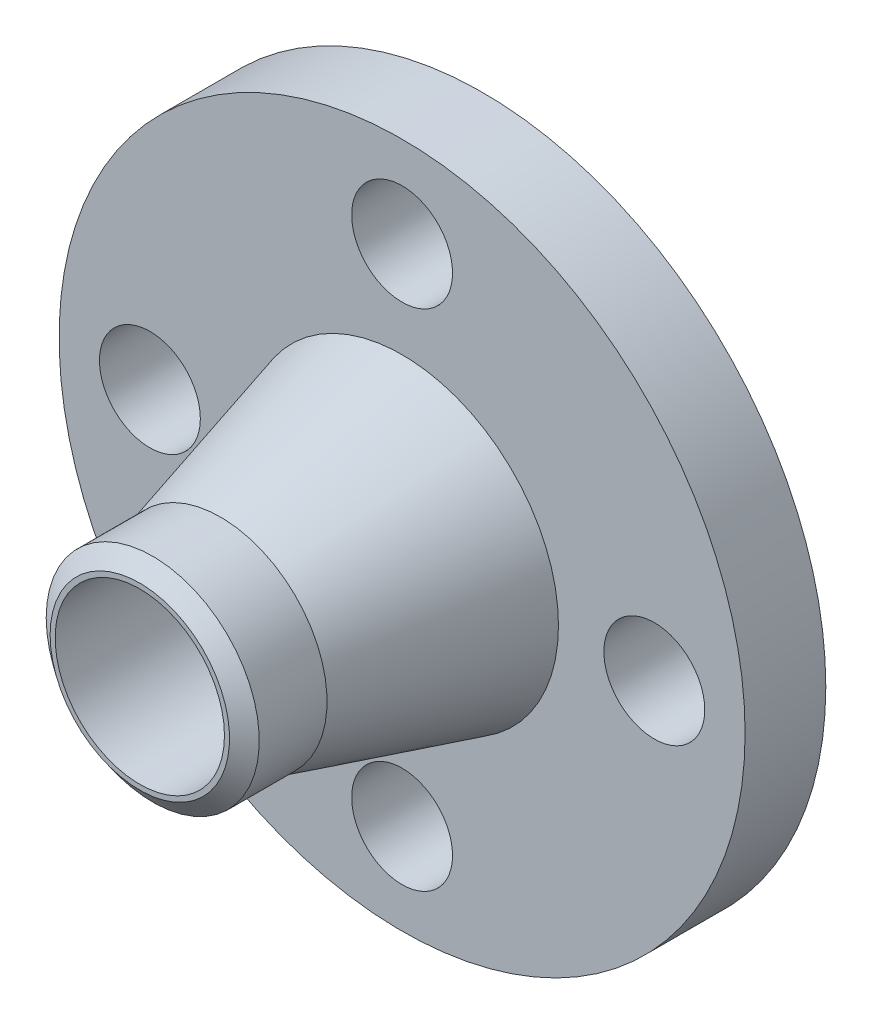
from build123d import *

# Parameters (mm, degrees)
SKETCH1_R         = 25.4
EXTRUDE1_DEPTH    = 1.5875
EXTRUDE2_START    = 1.5875
SKETCH1_3_R       = 53.975
EXTRUDE2_DEPTH    = 12.7
EXTRUDE3_START    = 14.2875
SKETCH1_4_R       = 16.764
EXTRUDE3_DEPTH    = 41.275
EXTRUDE4_START    = 1.5875
SKETCH1_5_R       = 7.9375
EXTRUDE4_DEPTH    = 12.7
CIRPATTERN1_COUNT = 4
EXTRUDE5_REACH    = 96.413
SKETCH3_R         = 13.3223


with BuildPart() as part:
    # Sketch1 → Extrude1 (new body)
    with BuildSketch(Plane.XY):
        Circle(SKETCH1_R)
    extrude(amount=EXTRUDE1_DEPTH)

    # Sketch1<3> → Extrude2 (add)
    with BuildSketch(Plane.XY.offset(EXTRUDE2_START)):
        Circle(SKETCH1_3_R)
    extrude(amount=EXTRUDE2_DEPTH)

    # Sketch1<4> → Extrude3 (add)
    with BuildSketch(Plane.XY.offset(EXTRUDE3_START)):
        Circle(SKETCH1_4_R)
    extrude(amount=EXTRUDE3_DEPTH)

    # Sketch4 → Revolve1 (revolve)
    with BuildSketch(Plane(origin=(0, 0, 0), x_dir=(0, 0, -1), z_dir=(1, 0, 0)), mode=Mode.PRIVATE) as revolve1_sk:
        Polygon((-42.8625, 16.764), (-14.2875, 24.60625), (-14.2875, 16.764), align=None)
    revolve(revolve1_sk.sketch.rotate(Axis((0, 0, -2.619375), (0, 0, 1)), 90), axis=Axis((0, 0, -2.619375), (0, 0, 1)))

    # Sketch1<5> → Extrude4 (cut)
    with BuildSketch(Plane.XY.offset(EXTRUDE4_START)):
        with Locations((0, 39.6875)):
            Circle(SKETCH1_5_R)
    extrude4 = extrude(amount=EXTRUDE4_DEPTH, mode=Mode.SUBTRACT)

    # CirPattern1: Extrude4 ×4 about axis
    cirpattern1_axis = Axis((0, 0, 0), (0, 0, 1))
    for i in range(1, CIRPATTERN1_COUNT):
        add(extrude4.rotate(cirpattern1_axis, i * 360 / CIRPATTERN1_COUNT), mode=Mode.SUBTRACT)

    # Sketch3 → Extrude5 (cut, up to next)
    with BuildSketch(Plane(origin=(0, 0, 55.5625), x_dir=(-1, 0, 0), z_dir=(0, 0, -1)), mode=Mode.PRIVATE) as extrude5_sk1:
        with Locations(Location((0, 0, 0), (0, 0, 180))):
            Circle(SKETCH3_R)
    extrude5_tool1 = extrude(extrude5_sk1.sketch, amount=EXTRUDE5_REACH, mode=Mode.PRIVATE) & part.part
    add(extrude5_tool1.solids().sort_by_distance((0, 0, 55.5625))[0], mode=Mode.SUBTRACT)

    # Sketch5 → Cut-Revolve1 (revolve, cut)
    with BuildSketch(Plane(origin=(0, 0, 0), x_dir=(0, 0, -1), z_dir=(1, 0, 0)), mode=Mode.PRIVATE) as cut_revolve1_sk:
        Polygon((-55.5625, 16.764), (-53.530656502, 16.764), (-55.5625, 14.11605), align=None)
    revolve(cut_revolve1_sk.sketch.rotate(Axis((0, 0, -2.619375), (0, 0, 1)), 90), axis=Axis((0, 0, -2.619375), (0, 0, 1)), mode=Mode.SUBTRACT)


solid = part.part
